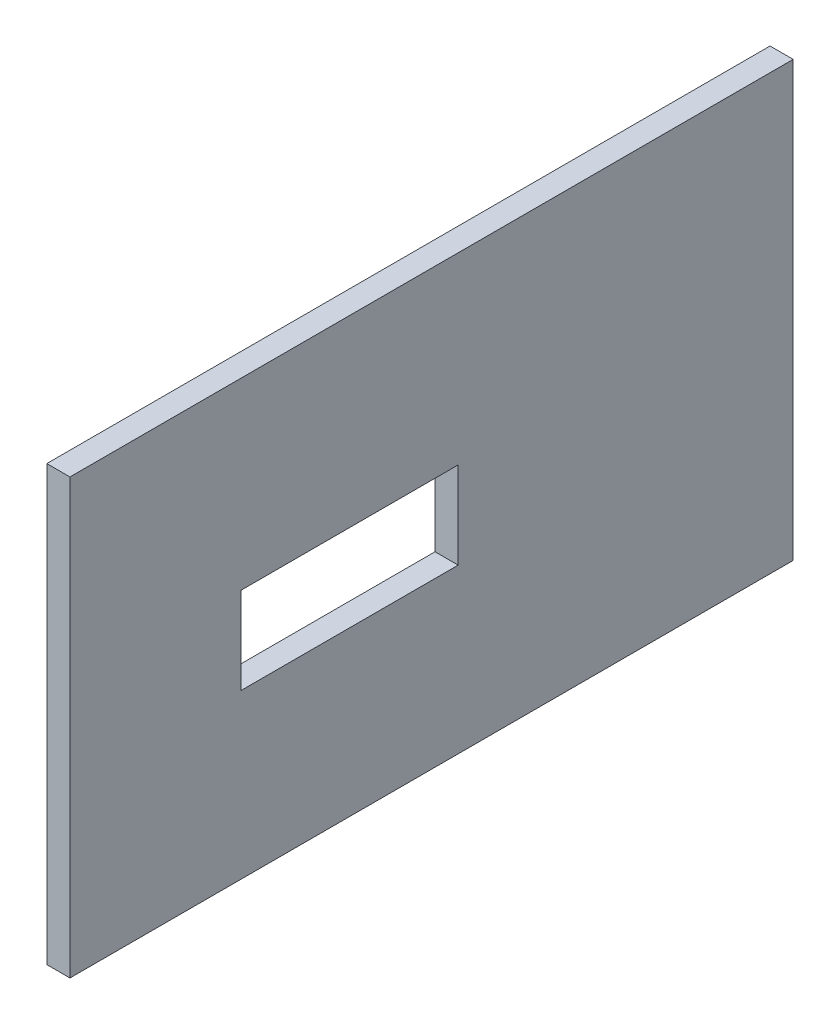
from build123d import *

# Parameters (mm, degrees)
SKETCH2_W           = 100
SKETCH2_H           = 60
BOSS_EXTRUDE1_DEPTH = 3.2
SKETCH3_W           = 30
SKETCH3_H           = 12
CUT_EXTRUDE1_DEPTH  = 3.2


with BuildPart() as part:
    # Sketch2 → Boss-Extrude1 (new body)
    with BuildSketch(Plane(origin=(0, 0, 0), x_dir=(0, 0, -1), z_dir=(1, 0, 0))):
        with Locations((-51.063551639, 7.4)):
            Rectangle(SKETCH2_W, SKETCH2_H)
    extrude(amount=BOSS_EXTRUDE1_DEPTH)

    # Sketch3 → Cut-Extrude1 (cut)
    with BuildSketch(Plane(origin=(3.2, 0, 0), x_dir=(0, 0, -1), z_dir=(1, 0, 0))):
        with Locations((-62.387722099, 6)):
            Rectangle(SKETCH3_W, SKETCH3_H)
    extrude(amount=-CUT_EXTRUDE1_DEPTH, mode=Mode.SUBTRACT)


solid = part.part
